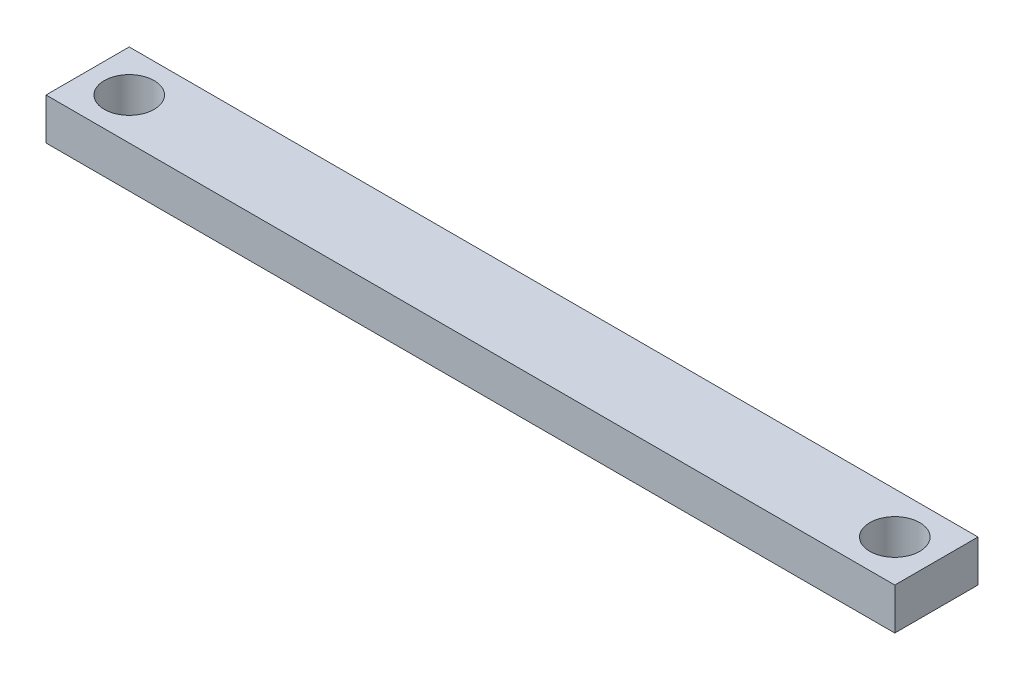
from build123d import *

# Parameters (mm, degrees)
SKETCH1_W           = 102
SKETCH1_H           = 10
SKETCH1_R           = 3
BOSS_EXTRUDE1_DEPTH = 2.5


with BuildPart() as part:
    # Sketch1 → Boss-Extrude1 (new, symmetric)
    with BuildSketch(Plane(origin=(0, 0, 0), x_dir=(1, 0, 0), z_dir=(0, 1, 0))):
        Rectangle(SKETCH1_W, SKETCH1_H)
        with Locations(Location((-46, 0, 0), (0, 0, 270))):
            Circle(SKETCH1_R, mode=Mode.SUBTRACT)
        with Locations(Location((46, 0, 0), (0, 0, 270))):
            Circle(SKETCH1_R, mode=Mode.SUBTRACT)
    extrude(amount=BOSS_EXTRUDE1_DEPTH, both=True)


solid = part.part
